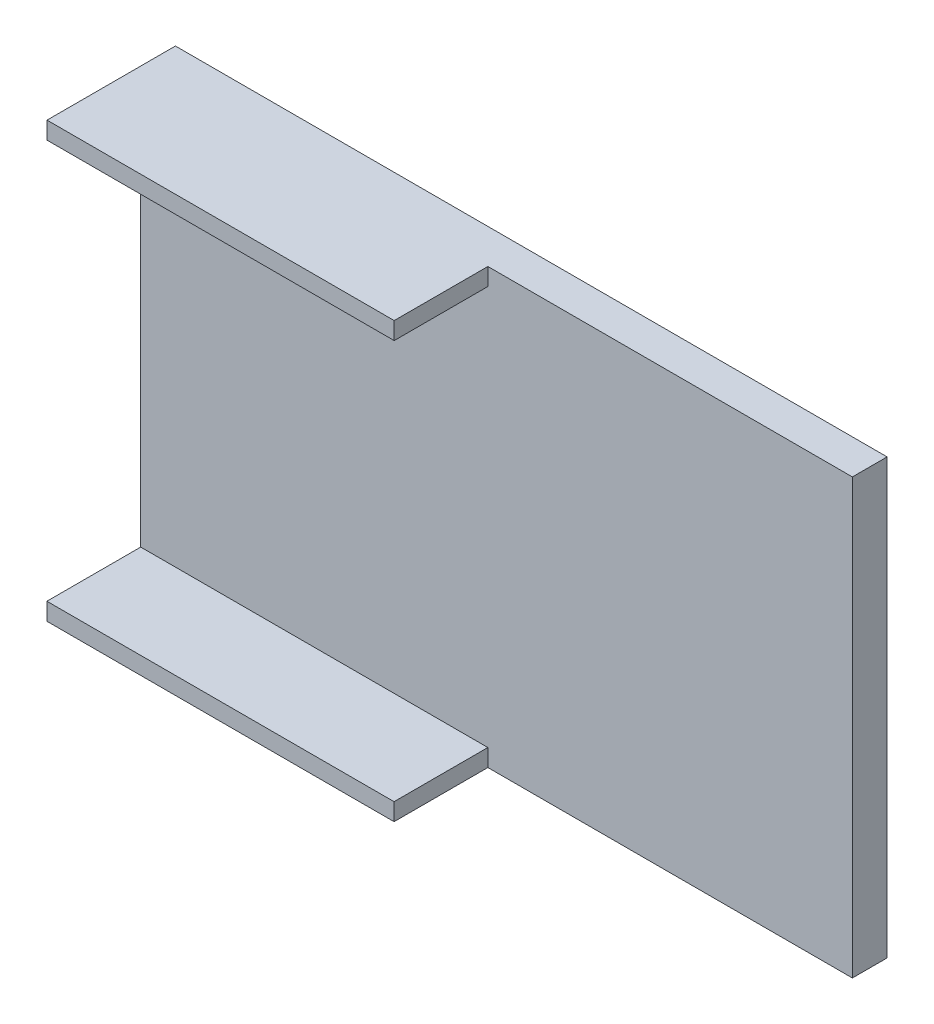
from build123d import *

# Parameters (mm, degrees)
ESQUISSE1_W        = 41
ESQUISSE1_H        = 25
BOSS_EXTRU_1_DEPTH = 2
ESQUISSE2_W        = 20
ESQUISSE2_H        = 1
BOSS_EXTRU_2_DEPTH = 5.396334009
ESQUISSE3_W        = 20
ESQUISSE3_H        = 1
BOSS_EXTRU_3_DEPTH = 5.403935709


with BuildPart() as part:
    # Esquisse1 → Boss.-Extru.1 (new body)
    with BuildSketch(Plane.XY):
        with Locations((20.669662079, 12.848600646)):
            Rectangle(ESQUISSE1_W, ESQUISSE1_H)
    extrude(amount=BOSS_EXTRU_1_DEPTH)

    # Esquisse2 → Boss.-Extru.2 (add)
    with BuildSketch(Plane.XY.offset(2)):
        with Locations((10.169662079, 24.848600646)):
            Rectangle(ESQUISSE2_W, ESQUISSE2_H)
    extrude(amount=BOSS_EXTRU_2_DEPTH)

    # Esquisse3 → Boss.-Extru.3 (add)
    with BuildSketch(Plane.XY.offset(2)):
        with Locations((10.169662079, 0.848600646)):
            Rectangle(ESQUISSE3_W, ESQUISSE3_H)
    extrude(amount=BOSS_EXTRU_3_DEPTH)


solid = part.part
